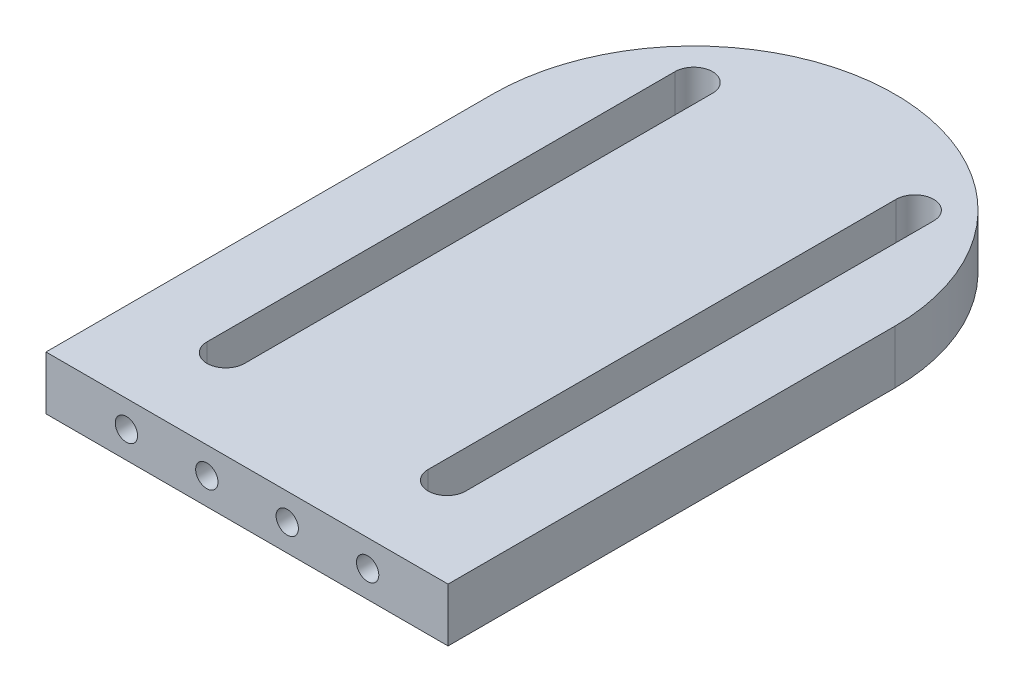
from build123d import *

# Parameters (mm, degrees)
EXTRUDE_1_DEPTH     = 6
CUT_EXTRUDE_1_DEPTH = 56.156595254
M3X0_51_D           = 2.5
M3X0_51_DEPTH       = 8.5
M3X0_51_TIP         = 0.751075774


with BuildPart() as part:
    # Эскиз1 → Бобышка-Вытянуть1 (new body)
    with BuildSketch(Plane(origin=(0, 0, 0), x_dir=(1, 0, 0), z_dir=(0, 1, 0))):
        with BuildLine():
            Line((-22.5, 0), (-22.5, -50))
            Line((-22.5, -50), (22.5, -50))
            Line((22.5, -50), (22.5, 0))
            ThreePointArc((22.5, 0), (0, 22.5), (-22.5, 0))
        make_face()
    extrude(amount=EXTRUDE_1_DEPTH)

    # Эскиз2 → Вырез-Вытянуть1 (cut, through all)
    with BuildSketch(Plane(origin=(0, 6, 0), x_dir=(1, 0, 0), z_dir=(0, 1, 0))):
        with BuildLine():
            Line((-10.274368671, 12.374368671), (-10.274368671, -40))
            ThreePointArc((-10.274368671, -40), (-12.374368671, -42.1), (-14.474368671, -40))
            Line((-14.474368671, -40), (-14.474368671, 12.374368671))
            ThreePointArc((-14.474368671, 12.374368671), (-12.374368671, 14.474368671), (-10.274368671, 12.374368671))
        make_face()
        with BuildLine():
            Line((10.274368671, 12.374368671), (10.274368671, -40))
            ThreePointArc((10.274368671, -40), (12.374368671, -42.1), (14.474368671, -40))
            Line((14.474368671, -40), (14.474368671, 12.374368671))
            ThreePointArc((14.474368671, 12.374368671), (12.374368671, 14.474368671), (10.274368671, 12.374368671))
        make_face()
    extrude(amount=-CUT_EXTRUDE_1_DEPTH, mode=Mode.SUBTRACT)

    # Отверстие обработанное метчиком M3x0.51
    with Locations(Plane.XY.offset(50)):
        with Locations((-13.5, 3), (-4.5, 3), (4.5, 3), (13.5, 3)):
            Hole(M3X0_51_D / 2, depth=M3X0_51_DEPTH)
            with Locations((0, 0, -(M3X0_51_DEPTH + M3X0_51_TIP / 2))):  # 118° drill point
                Cone(0, M3X0_51_D / 2, M3X0_51_TIP, mode=Mode.SUBTRACT)


solid = part.part
